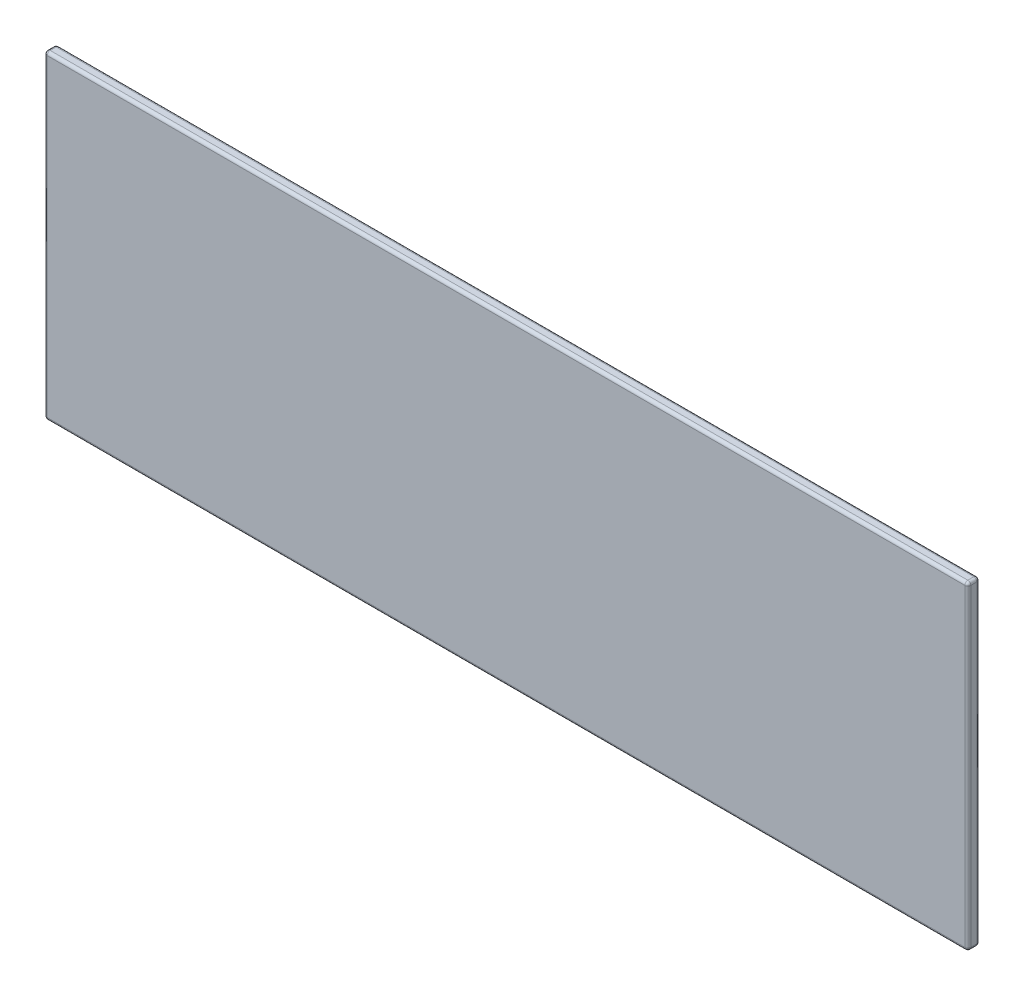
from build123d import *

# Parameters (mm, degrees)
SKETCH1_W           = 154.7
SKETCH1_H           = 53.5
BOSS_EXTRUDE1_DEPTH = 2
FILLET1_R           = 0.5


with BuildPart() as part:
    # Sketch1 → Boss-Extrude1 (new body)
    with BuildSketch(Plane.XY):
        Rectangle(SKETCH1_W, SKETCH1_H)
    extrude(amount=BOSS_EXTRUDE1_DEPTH)

    # Fillet1
    fillet1_edges = [part.edges().sort_by_distance(p)[0] for p in [
        (-77.35, 0, 2),
        (0, -26.75, 2),
        (77.35, 0, 2),
        (0, -26.75, 0),
        (-77.35, 0, 0),
        (0, 26.75, 0),
        (77.35, 0, 0),
        (77.35, -26.75, 1),
        (-77.35, -26.75, 1),
        (-77.35, 26.75, 1),
        (77.35, 26.75, 1),
        (0, 26.75, 2),
    ]]
    fillet(fillet1_edges, radius=FILLET1_R)


solid = part.part
